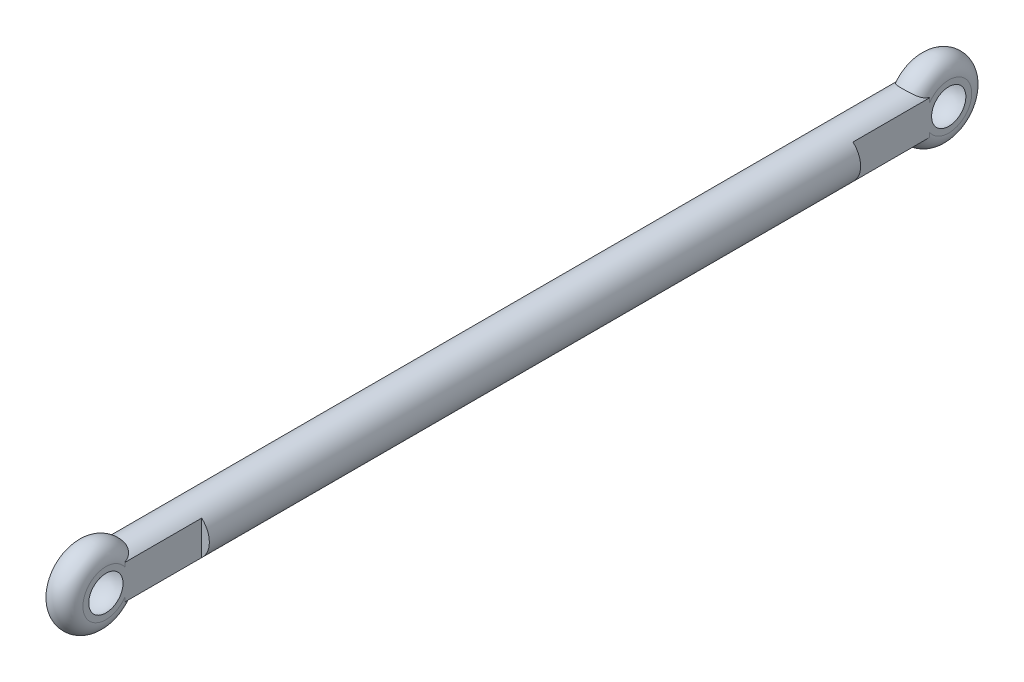
from build123d import *

# Parameters (mm, degrees)
SKETCH_1_R      = 3
EXTRUDE_1_DEPTH = 42.5
EXTRUDE_START   = 10
EXTRUDE_2_DEPTH = 10


with BuildPart() as part:
    # 草图1 → 凸台-拉伸1 (new, symmetric)
    with BuildSketch(Plane.XY):
        Circle(SKETCH_1_R)
    extrude(amount=EXTRUDE_1_DEPTH, both=True)

    # 草图2 → 凸台-拉伸2 (add)
    with BuildSketch(Plane.XY.offset(42.5).offset(EXTRUDE_START)):
        with BuildLine():
            ThreePointArc((2, 2.236067977), (0, 3), (-2, 2.236067977))
            Line((-2, 2.236067977), (-2, -2.236067977))
            ThreePointArc((-2, -2.236067977), (0, -3), (2, -2.236067977))
            Line((2, -2.236067977), (2, 2.236067977))
        make_face()
    extrude_2 = extrude(amount=-EXTRUDE_2_DEPTH)

    # 草图3 → 旋转1 (revolve)
    with BuildSketch(Plane.XY.offset(55)):
        with BuildLine():
            Line((-2, 3), (-2, 0))
            Line((-2, 0), (2, 0))
            Line((2, 0), (2, 3))
            ThreePointArc((2, 3), (0, 5), (-2, 3))
        make_face()
    revolve_1 = revolve(axis=Axis((0, 0, 55), (1, 0, 0)))

    # 草图4 → 切除-旋转1 (revolve, cut)
    with BuildSketch(Plane.XY.offset(55)):
        with BuildLine():
            Line((-3, 0), (3, 0))
            ThreePointArc((3, 0), (0, 3), (-3, 0))
        make_face()
    cut_revolve_1 = revolve(axis=Axis((-3.468207888, 0, 55), (1, 0, 0)), mode=Mode.SUBTRACT)

    # 镜向1: 凸台-拉伸2, 旋转1, 切除-旋转1 across plane
    add(extrude_2.mirror(Plane.XY))
    add(revolve_1.mirror(Plane.XY))
    add(cut_revolve_1.mirror(Plane.XY), mode=Mode.SUBTRACT)


solid = part.part
